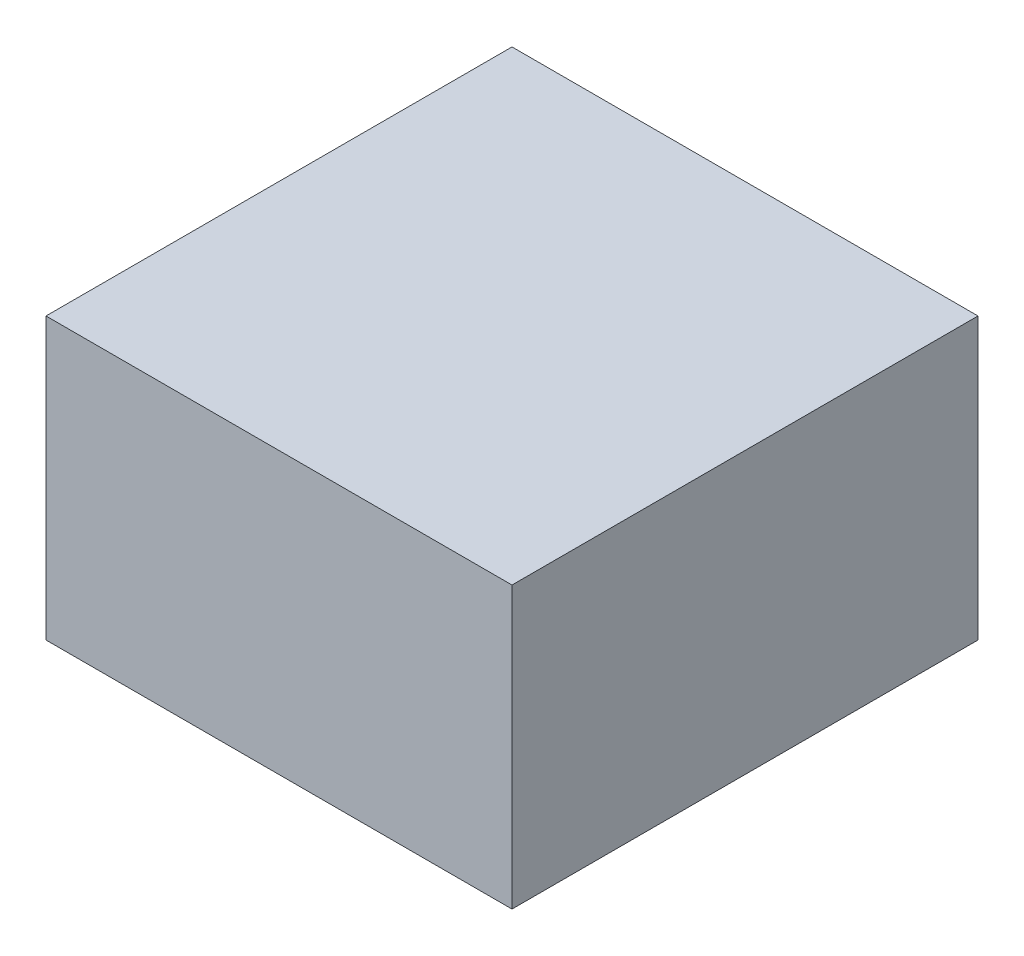
from build123d import *

# Parameters (mm, degrees)
SKETCH_1_W      = 44
SKETCH_1_H      = 44
EXTRUDE_1_DEPTH = 26.5


with BuildPart() as part:
    # 草圖1 → 填料-伸長1 (new body)
    with BuildSketch(Plane(origin=(0, 0, 0), x_dir=(1, 0, 0), z_dir=(0, 1, 0))):
        Rectangle(SKETCH_1_W, SKETCH_1_H)
    extrude(amount=EXTRUDE_1_DEPTH)


solid = part.part
